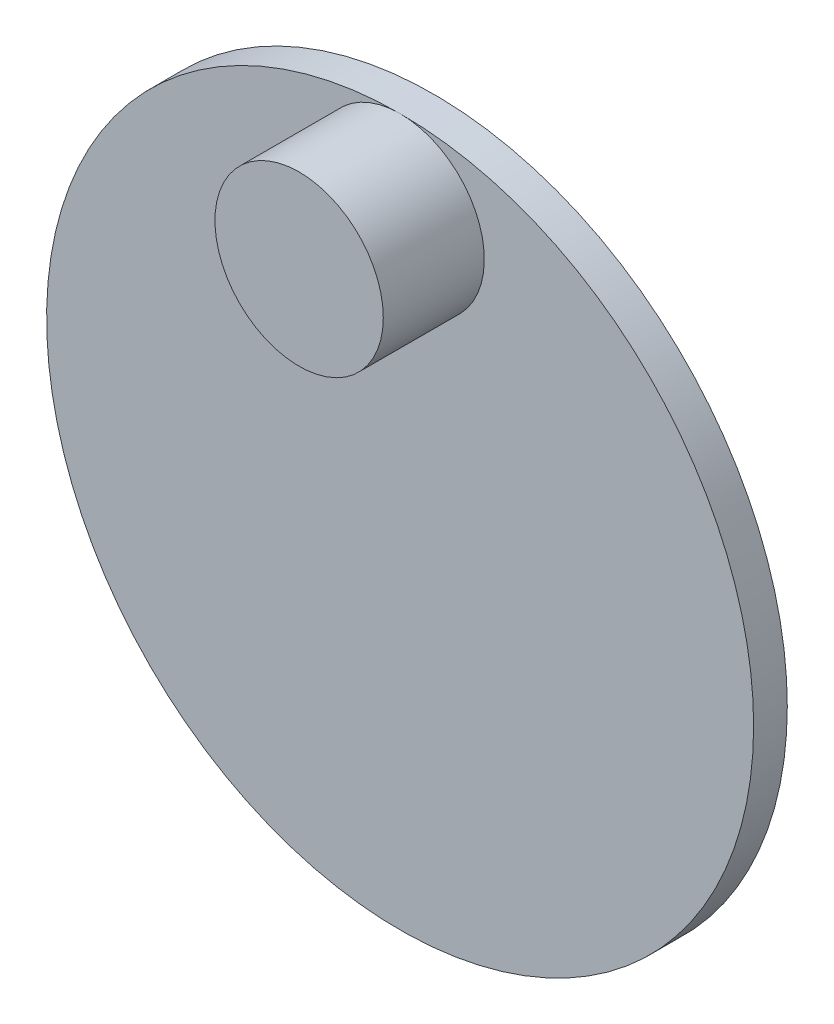
from build123d import *

# Parameters (mm, degrees)
SKETCH1_R           = 115
BOSS_EXTRUDE1_DEPTH = 10
SKETCH2_R           = 25
BOSS_EXTRUDE2_DEPTH = 30
SKETCH3_R           = 30
BOSS_EXTRUDE3_DEPTH = 30
CUT_EXTRUDE2_START  = -10
SKETCH4_R           = 115
SKETCH4_R_2         = 105
CUT_EXTRUDE2_DEPTH  = 10


with BuildPart() as part:
    # Sketch1 → Boss-Extrude1 (new body)
    with BuildSketch(Plane.XY):
        Circle(SKETCH1_R)
    extrude(amount=BOSS_EXTRUDE1_DEPTH)

    # Sketch2 → Boss-Extrude2 (add)
    with BuildSketch(Plane.XY.offset(10)):
        with Locations((0, 80)):
            Circle(SKETCH2_R)
    extrude(amount=BOSS_EXTRUDE2_DEPTH)

    # Sketch3 → Boss-Extrude3 (add)
    with BuildSketch(Plane(origin=(0, 0, 0), x_dir=(-1, 0, 0), z_dir=(0, 0, -1))):
        Circle(SKETCH3_R)
    extrude(amount=BOSS_EXTRUDE3_DEPTH)

    # Sketch4 → Cut-Extrude2 (cut)
    with BuildSketch(Plane.XY.offset(10).offset(CUT_EXTRUDE2_START)):
        Circle(SKETCH4_R)
        Circle(SKETCH4_R_2, mode=Mode.SUBTRACT)
    extrude(amount=CUT_EXTRUDE2_DEPTH, mode=Mode.SUBTRACT)


solid = part.part
